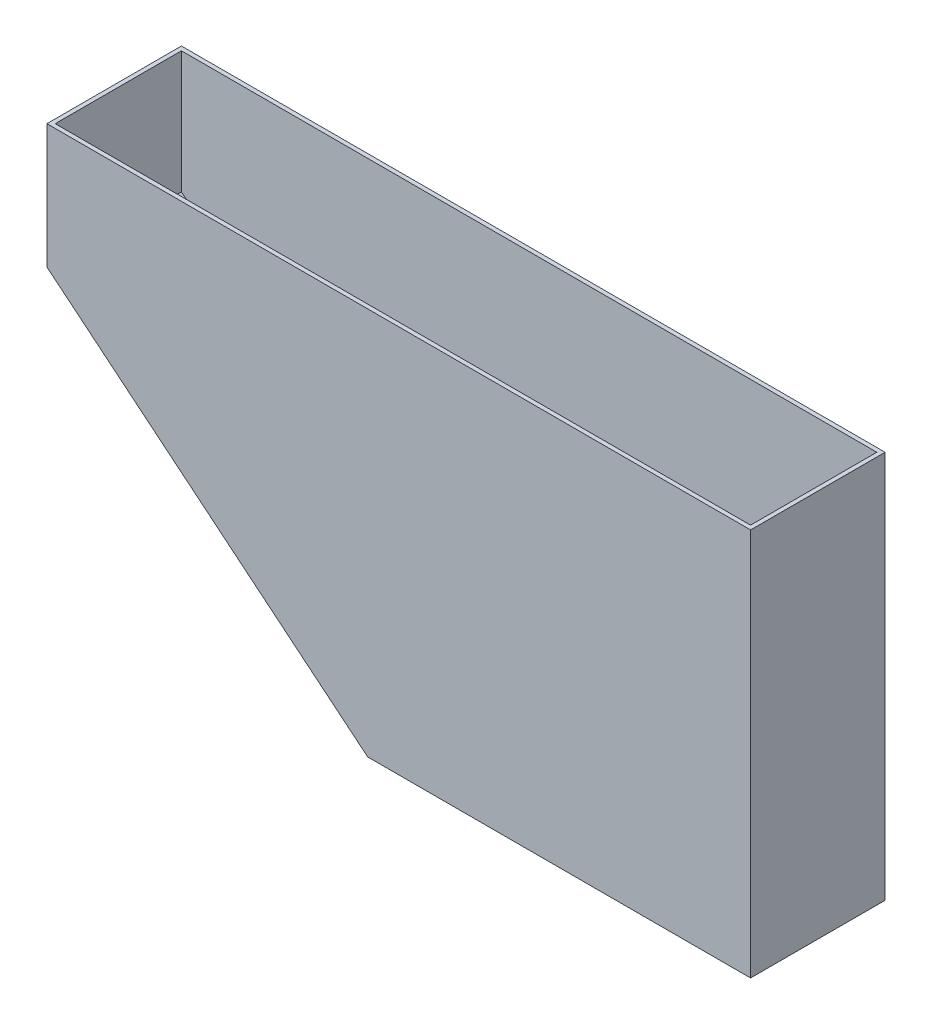
from build123d import *

# Parameters (mm, degrees)
BOSS_EXTRUDE1_DEPTH = 130
SHELL1_T            = -4


with BuildPart() as part:
    # Sketch1 → Boss-Extrude1 (new body)
    with BuildSketch(Plane.XY):
        Polygon((-304.073172001, 21.586402266), (5.926827999, -233.413597734), (375.926827999, -233.413597734), (375.926827999, 141.586402266), (-304.073172001, 141.586402266), align=None)
    extrude(amount=BOSS_EXTRUDE1_DEPTH)

    # Shell1
    shell1_openings = [part.faces().sort_by_distance(p)[0] for p in [
        (35.926827999, 141.586402266, 65),
    ]]
    offset(amount=SHELL1_T, openings=shell1_openings, kind=Kind.INTERSECTION)


solid = part.part
